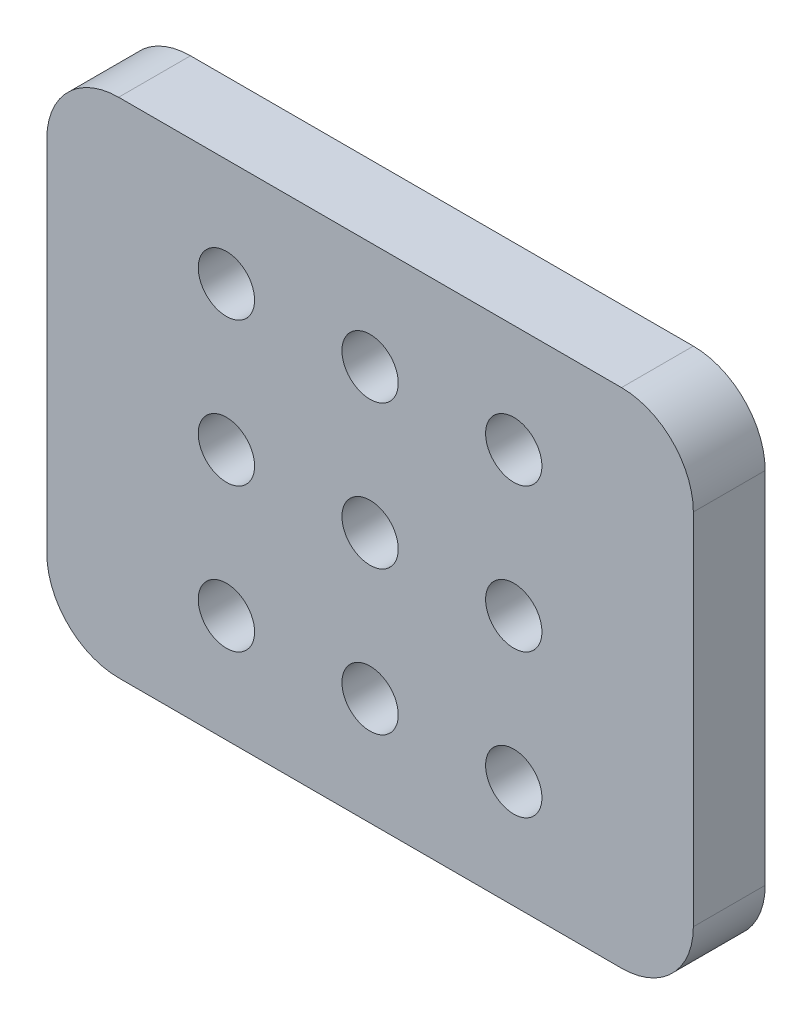
from build123d import *

# Parameters (mm, degrees)
SKETCH1_R           = 2.4892
BOSS_EXTRUDE1_DEPTH = 3.175
FILLET1_R           = 6.35


with BuildPart() as part:
    # Sketch1 → Boss-Extrude1 (new, symmetric)
    # profile 1 of 2: a face of its own
    with BuildSketch(Plane.XY):
        with BuildLine():
            Line((60.325, 47.625), (31.75, 47.625))
            Line((31.75, 47.625), (31.75, 40.5892))
            ThreePointArc((31.75, 40.5892), (33.5101302, 39.8601302), (34.2392, 38.1))
            ThreePointArc((34.2392, 38.1), (33.5101302, 36.3398698), (31.75, 35.6108))
            Line((31.75, 35.6108), (31.75, 27.8892))
            ThreePointArc((31.75, 27.8892), (33.5101302, 27.1601302), (34.2392, 25.4))
            ThreePointArc((34.2392, 25.4), (33.5101302, 23.6398698), (31.75, 22.9108))
            Line((31.75, 22.9108), (31.75, 15.1892))
            ThreePointArc((31.75, 15.1892), (33.5101302, 14.4601302), (34.2392, 12.7))
            ThreePointArc((34.2392, 12.7), (33.5101302, 10.9398698), (31.75, 10.2108))
            Line((31.75, 10.2108), (31.75, 3.175))
            Line((31.75, 3.175), (60.325, 3.175))
            Line((60.325, 3.175), (60.325, 47.625))
        make_face()
        with Locations((44.45, 12.7)):
            Circle(SKETCH1_R, mode=Mode.SUBTRACT)
        with Locations((44.45, 25.4)):
            Circle(SKETCH1_R, mode=Mode.SUBTRACT)
        with Locations((44.45, 38.1)):
            Circle(SKETCH1_R, mode=Mode.SUBTRACT)
    # profile 2 of 2: a face of its own
    with BuildSketch(Plane.XY):
        with BuildLine():
            Line((31.75, 40.5892), (31.75, 47.625))
            Line((31.75, 47.625), (3.175, 47.625))
            Line((3.175, 47.625), (3.175, 3.175))
            Line((3.175, 3.175), (31.75, 3.175))
            Line((31.75, 3.175), (31.75, 10.2108))
            ThreePointArc((31.75, 10.2108), (29.2608, 12.7), (31.75, 15.1892))
            Line((31.75, 15.1892), (31.75, 22.9108))
            ThreePointArc((31.75, 22.9108), (29.2608, 25.4), (31.75, 27.8892))
            Line((31.75, 27.8892), (31.75, 35.6108))
            ThreePointArc((31.75, 35.6108), (29.2608, 38.1), (31.75, 40.5892))
        make_face()
        with Locations((19.05, 12.7)):
            Circle(SKETCH1_R, mode=Mode.SUBTRACT)
        with Locations((19.05, 25.4)):
            Circle(SKETCH1_R, mode=Mode.SUBTRACT)
        with Locations((19.05, 38.1)):
            Circle(SKETCH1_R, mode=Mode.SUBTRACT)
    extrude(amount=BOSS_EXTRUDE1_DEPTH, both=True)

    # Fillet1
    fillet1_edges = [part.edges().sort_by_distance(p)[0] for p in [
        (60.325, 47.625, 0),
        (60.325, 3.175, 0),
        (3.175, 3.175, 0),
        (3.175, 47.625, 0),
    ]]
    fillet(fillet1_edges, radius=FILLET1_R)


solid = part.part
